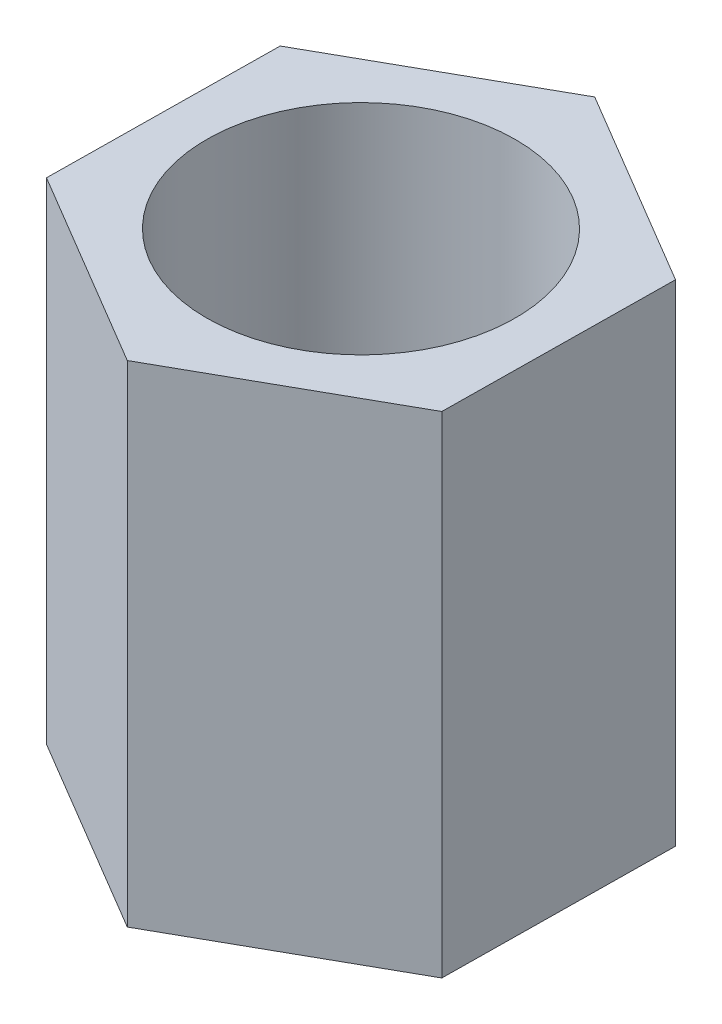
from build123d import *

# Parameters (mm, degrees)
SKETCH1_R           = 1.575
BOSS_EXTRUDE1_DEPTH = 5


with BuildPart() as part:
    # Sketch1 → Boss-Extrude1 (new body)
    with BuildSketch(Plane(origin=(0, 0, 0), x_dir=(1, 0, 0), z_dir=(0, 1, 0))):
        Polygon((2.024690694, -1.201063778), (2.05249709, 1.152901687), (0.027806396, 2.353965465), (-2.024690694, 1.201063778), (-2.05249709, -1.152901687), (-0.027806396, -2.353965465), align=None)
        with Locations(Location((0, 0, 0), (0, 0, 270))):
            Circle(SKETCH1_R, mode=Mode.SUBTRACT)
    extrude(amount=BOSS_EXTRUDE1_DEPTH)


solid = part.part
